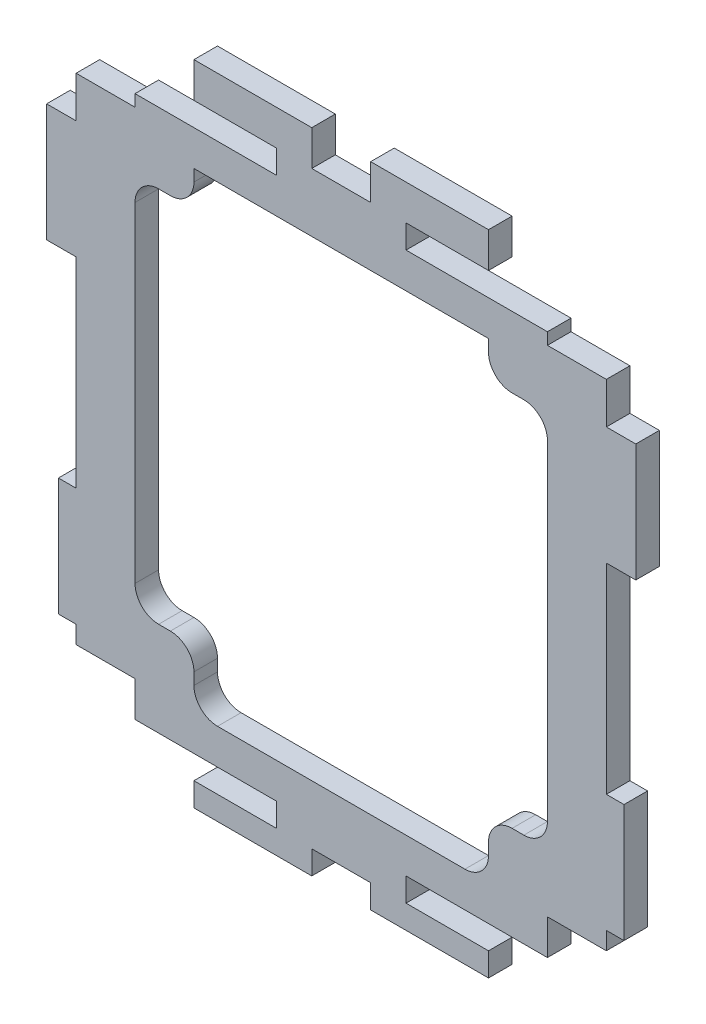
from build123d import *

# Parameters (mm, degrees)
EXTRUDE_1_DEPTH = 2


with BuildPart() as part:
    # Model → 凸台-拉伸1 (new body)
    with BuildSketch(Plane.XY):
        Polygon((1277.912077, 487.080631391), (1277.912077, 483.580631391), (1275.412077, 483.580631391), (1275.412077, 473.580631391), (1277.912077, 473.580631391), (1277.912077, 456.580631391), (1276.412077, 456.580631391), (1276.412077, 446.580631391), (1277.912077, 446.580631391), (1277.912077, 445.080631391), (1282.912077, 445.080631391), (1282.912077, 442.080631391), (1294.912077, 442.080631391), (1294.912077, 440.080631391), (1287.912077, 440.080631391), (1287.912077, 438.080631391), (1297.912077, 438.080631391), (1297.912077, 440.080631391), (1302.912077, 440.080631391), (1302.912077, 438.080631391), (1312.912077, 438.080631391), (1312.912077, 440.080631391), (1305.912077, 440.080631391), (1305.912077, 442.080631391), (1317.912077, 442.080631391), (1317.912077, 445.080631391), (1322.912077, 445.080631391), (1322.912077, 446.580631391), (1324.412077, 446.580631391), (1324.412077, 456.580631391), (1322.912077, 456.580631391), (1322.912077, 473.580631391), (1325.412077, 473.580631391), (1325.412077, 483.580631391), (1322.912077, 483.580631391), (1322.912077, 487.080631391), (1317.912077, 487.080631391), (1317.912077, 488.080631391), (1305.912077, 488.080631391), (1305.912077, 490.080631391), (1312.912077, 490.080631391), (1312.912077, 493.080631391), (1302.912077, 493.080631391), (1302.912077, 490.080631391), (1297.912077, 490.080631391), (1297.912077, 493.080631391), (1287.912077, 493.080631391), (1287.912077, 490.080631391), (1294.912077, 490.080631391), (1294.912077, 488.080631391), (1282.912077, 488.080631391), (1282.912077, 487.080631391), align=None)
        with BuildLine():
            Line((1284.912077, 482.080631391), (1285.912077, 482.080631391))
            ThreePointArc((1285.912077, 482.080631391), (1287.326290562, 482.666417828), (1287.912077, 484.080631391))
            Line((1287.912077, 484.080631391), (1287.912077, 485.080631391))
            Line((1287.912077, 485.080631391), (1312.912077, 485.080631391))
            Line((1312.912077, 485.080631391), (1312.912077, 484.080631391))
            ThreePointArc((1312.912077, 484.080631391), (1313.497863438, 482.666417828), (1314.912077, 482.080631391))
            Line((1314.912077, 482.080631391), (1315.912077, 482.080631391))
            ThreePointArc((1315.912077, 482.080631391), (1317.326290562, 481.494844953), (1317.912077, 480.080631391))
            Line((1317.912077, 480.080631391), (1317.912077, 452.080631391))
            ThreePointArc((1317.912077, 452.080631391), (1317.326290562, 450.666417828), (1315.912077, 450.080631391))
            Line((1315.912077, 450.080631391), (1314.912077, 450.080631391))
            ThreePointArc((1314.912077, 450.080631391), (1313.497863438, 449.494844953), (1312.912077, 448.080631391))
            Line((1312.912077, 448.080631391), (1312.912077, 447.080631391))
            ThreePointArc((1312.912077, 447.080631391), (1312.326290562, 445.666417828), (1310.912077, 445.080631391))
            Line((1310.912077, 445.080631391), (1289.912077, 445.080631391))
            ThreePointArc((1289.912077, 445.080631391), (1288.497863438, 445.666417828), (1287.912077, 447.080631391))
            Line((1287.912077, 447.080631391), (1287.912077, 448.080631391))
            ThreePointArc((1287.912077, 448.080631391), (1287.326290562, 449.494844953), (1285.912077, 450.080631391))
            Line((1285.912077, 450.080631391), (1284.912077, 450.080631391))
            ThreePointArc((1284.912077, 450.080631391), (1283.497863438, 450.666417828), (1282.912077, 452.080631391))
            Line((1282.912077, 452.080631391), (1282.912077, 480.080631391))
            ThreePointArc((1282.912077, 480.080631391), (1283.497863438, 481.494844953), (1284.912077, 482.080631391))
        make_face(mode=Mode.SUBTRACT)
    extrude(amount=EXTRUDE_1_DEPTH)


solid = part.part
